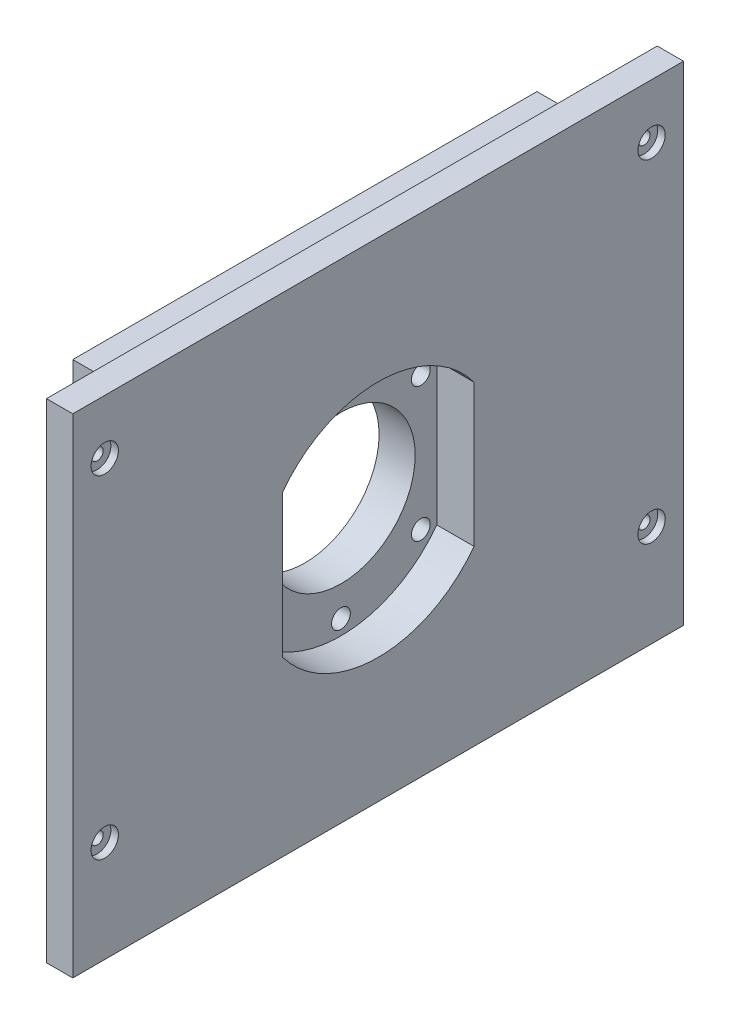
from build123d import *

# Parameters (mm, degrees)
SKETCH1_W                               = 325
SKETCH1_H                               = 260
BOSS_EXTRUDE1_DEPTH                     = 39
CBORE_FOR_M6_HEX_HEAD_BOLT1_D           = 6.4
CBORE_FOR_M6_HEX_HEAD_BOLT1_DEPTH       = 30
CBORE_FOR_M6_HEX_HEAD_BOLT1_CBORE_D     = 14.547
CBORE_FOR_M6_HEX_HEAD_BOLT1_CBORE_DEPTH = 4
CBORE_FOR_M6_HEX_HEAD_BOLT1_TIP         = 1.922753981
SKETCH3_R                               = 39.51
CUT_EXTRUDE2_DEPTH                      = 39
CUT_EXTRUDE3_DEPTH                      = 19.8
F_10_0MM_DOWEL_HOLE1_D                  = 10
F_10_0MM_DOWEL_HOLE1_DEPTH              = 30
F_10_0MM_DOWEL_HOLE1_TIP                = 3.004303095
SKETCH18_W                              = 39
SKETCH18_H                              = 260
CUT_EXTRUDE5_DEPTH                      = 25
SKETCH19_W                              = 25
SKETCH19_H                              = 247
CUT_EXTRUDE6_DEPTH                      = 14
F_6_0MM_DOWEL_HOLE1_D                   = 6
F_6_0MM_DOWEL_HOLE1_DEPTH               = 15
F_6_0MM_DOWEL_HOLE1_TIP                 = 1.802581857
CUT_EXTRUDE7_DEPTH                      = 222.463315247
CUT_EXTRUDE7_DEPTH_BACK                 = 222.463315247
SKETCH23_W                              = 25
SKETCH23_H                              = 14


with BuildPart() as part:
    # Sketch1 → Boss-Extrude1 (new body)
    with BuildSketch(Plane(origin=(0, 0, 0), x_dir=(0, 0, -1), z_dir=(1, 0, 0))):
        with Locations((12.5, 0)):
            Rectangle(SKETCH1_W, SKETCH1_H)
    extrude(amount=BOSS_EXTRUDE1_DEPTH)

    # CBORE for M6 Hex Head Bolt1
    with Locations(Plane(origin=(39, 0, 0), x_dir=(0, 0, -1), z_dir=(1, 0, 0))):
        with Locations((158, 101), (158, -76), (-133, 101), (-133, -76)):
            CounterBoreHole(CBORE_FOR_M6_HEX_HEAD_BOLT1_D / 2, CBORE_FOR_M6_HEX_HEAD_BOLT1_CBORE_D / 2, CBORE_FOR_M6_HEX_HEAD_BOLT1_CBORE_DEPTH, depth=CBORE_FOR_M6_HEX_HEAD_BOLT1_DEPTH)
            with Locations((0, 0, -(CBORE_FOR_M6_HEX_HEAD_BOLT1_DEPTH + CBORE_FOR_M6_HEX_HEAD_BOLT1_TIP / 2))):  # 118° drill point
                Cone(0, CBORE_FOR_M6_HEX_HEAD_BOLT1_D / 2, CBORE_FOR_M6_HEX_HEAD_BOLT1_TIP, mode=Mode.SUBTRACT)

    # Sketch3 → Cut-Extrude2 (cut)
    with BuildSketch(Plane(origin=(39, 0, 0), x_dir=(0, 0, -1), z_dir=(1, 0, 0))):
        with Locations((12.5, 0)):
            Circle(SKETCH3_R)
    extrude(amount=-CUT_EXTRUDE2_DEPTH, mode=Mode.SUBTRACT)

    # Sketch5 → Cut-Extrude3 (cut)
    with BuildSketch(Plane(origin=(39, 0, 0), x_dir=(0, 0, -1), z_dir=(1, 0, 0))):
        with BuildLine():
            Line((-38.5, 37.85), (-38.5, -37.85))
            ThreePointArc((-38.5, -37.85), (12.5, -63.518135124), (63.5, -37.85))
            Line((63.5, -37.85), (63.5, 37.85))
            ThreePointArc((63.5, 37.85), (12.5, 63.518135124), (-38.5, 37.85))
        make_face()
    extrude(amount=-CUT_EXTRUDE3_DEPTH, mode=Mode.SUBTRACT)

    # Ø10.0mm Dowel Hole1
    with Locations(Plane(origin=(39, 0, 0), x_dir=(0, 0, -1), z_dir=(1, 0, 0))):
        with Locations((12.5, 55.5), (55.015466593, 35.674712338), (-30.015466593, 35.674712338), (-30.015466593, -35.674712338), (12.5, -55.5), (55.015466593, -35.674712338)):
            Hole(F_10_0MM_DOWEL_HOLE1_D / 2, depth=F_10_0MM_DOWEL_HOLE1_DEPTH)
            with Locations((0, 0, -(F_10_0MM_DOWEL_HOLE1_DEPTH + F_10_0MM_DOWEL_HOLE1_TIP / 2))):  # 118° drill point
                Cone(0, F_10_0MM_DOWEL_HOLE1_D / 2, F_10_0MM_DOWEL_HOLE1_TIP, mode=Mode.SUBTRACT)

    # Sketch18 → Cut-Extrude5 (cut)
    with BuildSketch(Plane(origin=(0, 0, 0), x_dir=(0, 0, -1), z_dir=(1, 0, 0))):
        with Locations((155.5, 0)):
            Rectangle(SKETCH18_W, SKETCH18_H)
        with Locations((-130.5, 0)):
            Rectangle(SKETCH18_W, SKETCH18_H)
    extrude(amount=CUT_EXTRUDE5_DEPTH, mode=Mode.SUBTRACT)

    # Sketch19 → Cut-Extrude6 (cut)
    with BuildSketch(Plane(origin=(0, -130, 0), x_dir=(-1, 0, 0), z_dir=(0, -1, 0))):
        with Locations((-12.5, 12.5)):
            Rectangle(SKETCH19_W, SKETCH19_H)
    extrude(amount=-CUT_EXTRUDE6_DEPTH, mode=Mode.SUBTRACT)

    # Ø6.0mm Dowel Hole1
    with Locations(Plane(origin=(0, -116, 0), x_dir=(-1, 0, 0), z_dir=(0, -1, 0))):
        with Locations((-14, 96.5), (-14, -71.5)):
            Hole(F_6_0MM_DOWEL_HOLE1_D / 2, depth=F_6_0MM_DOWEL_HOLE1_DEPTH)
            with Locations((0, 0, -(F_6_0MM_DOWEL_HOLE1_DEPTH + F_6_0MM_DOWEL_HOLE1_TIP / 2))):  # 118° drill point
                Cone(0, F_6_0MM_DOWEL_HOLE1_D / 2, F_6_0MM_DOWEL_HOLE1_TIP, mode=Mode.SUBTRACT)

    # Sketch23 → Cut-Extrude7 (cut, two sides: drawn at the far end of the back side and taken through both)
    with BuildSketch(Plane.XY.offset(-CUT_EXTRUDE7_DEPTH_BACK)):
        with Locations((12.5, 123)):
            Rectangle(SKETCH23_W, SKETCH23_H)
    extrude(amount=CUT_EXTRUDE7_DEPTH + CUT_EXTRUDE7_DEPTH_BACK, mode=Mode.SUBTRACT)


solid = part.part
